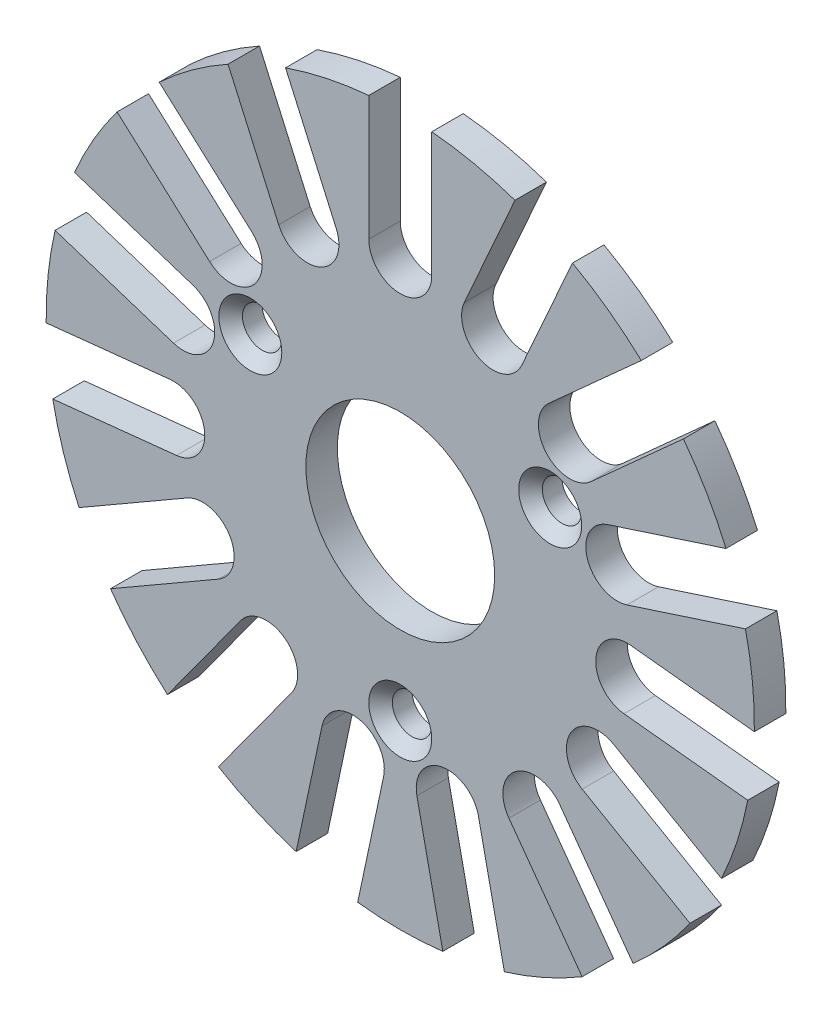
from build123d import *

# Parameters (mm, degrees)
SKETCH1_R                     = 1
SKETCH1_R_2                   = 6
BOSS_EXTRUDE1_DEPTH           = 2
CSK_FOR_M3_SFHCS1_D           = 2.5
CSK_FOR_M3_SFHCS1_DEPTH       = 9.5
CSK_FOR_M3_SFHCS1_CSINK_D     = 4
CSK_FOR_M3_SFHCS1_CSINK_ANGLE = 90
CSK_FOR_M3_SFHCS1_TIP         = 0.751075774


with BuildPart() as part:
    # Sketch1 → Boss-Extrude1 (new body)
    with BuildSketch(Plane(origin=(0, 0, 0), x_dir=(-1, 0, 0), z_dir=(0, 0, -1))):
        with BuildLine():
            Line((-15.316309042, 17.102154929), (-9.437338757, 11.808706309))
            ThreePointArc((-9.437338757, 11.808706309), (-9.289310319, 8.984155445), (-12.113861182, 8.836127007))
            Line((-12.113861182, 8.836127007), (-17.992831467, 14.129575627))
            ThreePointArc((-17.992831467, 14.129575627), (-19.485571585, 11.870022867), (-20.696031618, 9.447495623))
            Line((-20.696031618, 9.447495623), (-13.172285497, 7.002882316))
            ThreePointArc((-13.172285497, 7.002882316), (-11.888206454, 4.482735294), (-14.408353475, 3.198656251))
            Line((-14.408353475, 3.198656251), (-21.932099596, 5.643269556))
            ThreePointArc((-21.932099596, 5.643269556), (-22.376742646, 2.971913289), (-22.497222312, 0.266486078))
            Line((-22.497222312, 0.266486078), (-14.62962441, 1.093403939))
            ThreePointArc((-14.62962441, 1.093403939), (-12.431523692, -0.686582926), (-14.211510557, -2.884683643))
            Line((-14.211510557, -2.884683643), (-22.079108459, -3.711601503))
            ThreePointArc((-22.079108459, -3.711601503), (-21.398771617, -6.332859507), (-20.408438887, -8.853393742))
            Line((-20.408438887, -8.853393742), (-13.557368355, -4.897926326))
            ThreePointArc((-13.557368355, -4.897926326), (-10.825317547, -5.629977134), (-11.557368355, -8.362027942))
            Line((-11.557368355, -8.362027942), (-18.408438886, -12.317495358))
            ThreePointArc((-18.408438886, -12.317495358), (-16.720758571, -14.435415779), (-14.790850969, -16.335233771))
            Line((-14.790850969, -16.335233771), (-10.140920148, -9.935153049))
            ThreePointArc((-10.140920148, -9.935153049), (-7.347315654, -9.492689564), (-6.90485217, -12.286294058))
            Line((-6.90485217, -12.286294058), (-11.554782995, -18.686374777))
            ThreePointArc((-11.554782995, -18.686374777), (-9.151574469, -19.934749931), (-6.615790555, -20.885355888))
            Line((-6.615790555, -20.885355888), (-4.971014718, -13.147293963))
            ThreePointArc((-4.971014718, -13.147293963), (-2.598896135, -11.606822144), (-1.058424316, -13.978940727))
            Line((-1.058424316, -13.978940727), (-2.703200152, -21.717002651))
            ThreePointArc((-2.703200152, -21.717002651), (-3e-09, -21.879977134), (2.703200146, -21.717002651))
            Line((2.703200146, -21.717002651), (1.058424314, -13.978940725))
            ThreePointArc((1.058424314, -13.978940725), (2.598896135, -11.606822143), (4.971014718, -13.147293963))
            Line((4.971014718, -13.147293963), (6.615790554, -20.885355888))
            ThreePointArc((6.615790554, -20.885355888), (9.151574469, -19.934749931), (11.554782995, -18.686374777))
            Line((11.554782995, -18.686374777), (6.904852169, -12.286294058))
            ThreePointArc((6.904852169, -12.286294058), (7.347315653, -9.492689564), (10.140920146, -9.935153048))
            Line((10.140920146, -9.935153048), (14.790850972, -16.335233768))
            ThreePointArc((14.790850972, -16.335233768), (16.720758571, -14.435415779), (18.408438883, -12.317495361))
            Line((18.408438883, -12.317495361), (11.557368352, -8.362027946))
            ThreePointArc((11.557368352, -8.362027946), (10.825317543, -5.629977135), (13.557368354, -4.897926327))
            Line((13.557368354, -4.897926327), (20.408438886, -8.853393742))
            ThreePointArc((20.408438886, -8.853393742), (21.398771616, -6.332859507), (22.079108458, -3.711601502))
            Line((22.079108458, -3.711601502), (14.211510556, -2.884683643))
            ThreePointArc((14.211510556, -2.884683643), (12.431523691, -0.686582926), (14.629624409, 1.093403939))
            Line((14.629624409, 1.093403939), (22.497222311, 0.266486078))
            ThreePointArc((22.497222311, 0.266486078), (22.376742645, 2.971913287), (21.932099596, 5.643269552))
            Line((21.932099596, 5.643269552), (14.408353473, 3.19865625))
            ThreePointArc((14.408353473, 3.19865625), (11.888206452, 4.482735295), (13.172285497, 7.002882316))
            Line((13.172285497, 7.002882316), (20.696031618, 9.447495621))
            ThreePointArc((20.696031618, 9.447495621), (19.485571584, 11.870022866), (17.992831465, 14.129575628))
            Line((17.992831465, 14.129575628), (12.113861182, 8.836127007))
            ThreePointArc((12.113861182, 8.836127007), (9.289310318, 8.984155445), (9.437338756, 11.808706308))
            Line((9.437338756, 11.808706308), (15.316309041, 17.102154929))
            ThreePointArc((15.316309041, 17.102154929), (13.225168178, 18.822905238), (10.94243932, 20.279957294))
            Line((10.94243932, 20.279957294), (7.724772239, 13.052958714))
            ThreePointArc((7.724772239, 13.052958714), (5.084208037, 12.039341086), (4.070590408, 14.679905287))
            Line((4.070590408, 14.679905287), (7.288257486, 21.906903868))
            ThreePointArc((7.288257486, 21.906903868), (4.67801304, 22.628343883), (1.999999993, 23.030957697))
            Line((1.999999993, 23.030957697), (1.999999993, 15.120022866))
            ThreePointArc((1.999999993, 15.120022866), (-1e-09, 13.120022872), (-1.999999995, 15.120022866))
            Line((-1.999999995, 15.120022866), (-1.999999995, 23.030957697))
            ThreePointArc((-1.999999995, 23.030957697), (-4.67801304, 22.628343883), (-7.288257483, 21.906903869))
            Line((-7.288257483, 21.906903869), (-4.070590409, 14.679905287))
            ThreePointArc((-4.070590409, 14.679905287), (-5.084208039, 12.039341085), (-7.72477224, 13.052958715))
            Line((-7.72477224, 13.052958715), (-10.942439317, 20.279957296))
            ThreePointArc((-10.942439317, 20.279957296), (-13.225168177, 18.822905239), (-15.316309042, 17.102154929))
        make_face()
        with Locations(Location((9.526279442, 6.120022866, 0), (0, 0, 180))):
            Circle(SKETCH1_R, mode=Mode.SUBTRACT)
        with Locations(Location((-9.526279442, 6.120022866, 0), (0, 0, 180))):
            Circle(SKETCH1_R, mode=Mode.SUBTRACT)
        with Locations(Location((0, -10.379977134, 0), (0, 0, 180))):
            Circle(SKETCH1_R, mode=Mode.SUBTRACT)
        with Locations(Location((0, 0.620022866, 0), (0, 0, 180))):
            Circle(SKETCH1_R_2, mode=Mode.SUBTRACT)
    extrude(amount=-BOSS_EXTRUDE1_DEPTH)

    # CSK for M3 SFHCS1
    with Locations(Plane(origin=(-9.526279442, 6.120022866, 2), x_dir=(1, 0, 0), z_dir=(0, 0, 1))):
        with Locations((0, 0), (19.052558884, 0), (9.526279442, -16.5)):
            CounterSinkHole(CSK_FOR_M3_SFHCS1_D / 2, CSK_FOR_M3_SFHCS1_CSINK_D / 2, depth=CSK_FOR_M3_SFHCS1_DEPTH, counter_sink_angle=CSK_FOR_M3_SFHCS1_CSINK_ANGLE)
            with Locations((0, 0, -(CSK_FOR_M3_SFHCS1_DEPTH + CSK_FOR_M3_SFHCS1_TIP / 2))):  # 118° drill point
                Cone(0, CSK_FOR_M3_SFHCS1_D / 2, CSK_FOR_M3_SFHCS1_TIP, mode=Mode.SUBTRACT)


solid = part.part
